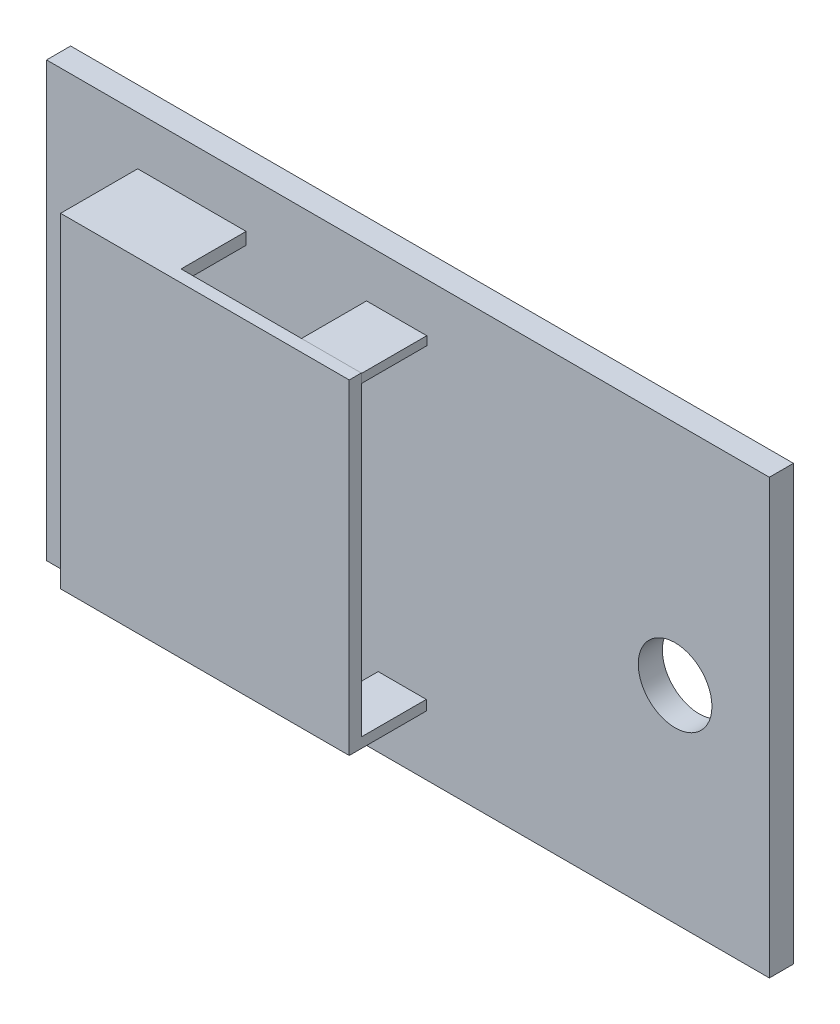
from build123d import *

# Parameters (mm, degrees)
SKETCH1_W           = 300
SKETCH1_H           = 180
SKETCH1_R           = 15.290295186
BOSS_EXTRUDE1_DEPTH = 10
SKETCH2_W           = 25
SKETCH2_H           = 3.625381299
SKETCH2_W_2         = 20
SKETCH2_H_2         = 4.172919767
BOSS_EXTRUDE2_DEPTH = 27
SKETCH3_W           = 119.797948109
SKETCH3_H           = 135
BOSS_EXTRUDE3_DEPTH = 5


with BuildPart() as part:
    # Sketch1 → Boss-Extrude1 (new body)
    with BuildSketch(Plane.XY):
        with Locations((50.602409639, -56.56626506)):
            Rectangle(SKETCH1_W, SKETCH1_H)
        with Locations((161.4744217, -60.89830155)):
            Circle(SKETCH1_R, mode=Mode.SUBTRACT)
    extrude(amount=BOSS_EXTRUDE1_DEPTH)

    # Sketch2 → Boss-Extrude2 (add)
    with BuildSketch(Plane.XY.offset(10)):
        Polygon((-61.566986646, 8.214667576), (-61.566986646, -116.785332424), (-61.566986646, -121.785332424), (20.433013354, -121.785332424), (20.433013354, -116.785332424), (-56.566986646, -116.785332424), (-56.566986646, 8.214667576), (-16.566986646, 8.214667576), (-16.566986646, 13.214667576), (-56.566986646, 13.214667576), (-61.566986646, 13.214667576), align=None)
        with Locations((45.914281805, 11.395862513)):
            Rectangle(SKETCH2_W, SKETCH2_H)
        with Locations((48.230961463, -119.698872541)):
            Rectangle(SKETCH2_W_2, SKETCH2_H_2)
    extrude(amount=BOSS_EXTRUDE2_DEPTH)

    # Sketch3 → Boss-Extrude3 (add)
    with BuildSketch(Plane.XY.offset(37)):
        with Locations((-1.668012591, -54.285332424)):
            Rectangle(SKETCH3_W, SKETCH3_H)
    extrude(amount=BOSS_EXTRUDE3_DEPTH)


solid = part.part
